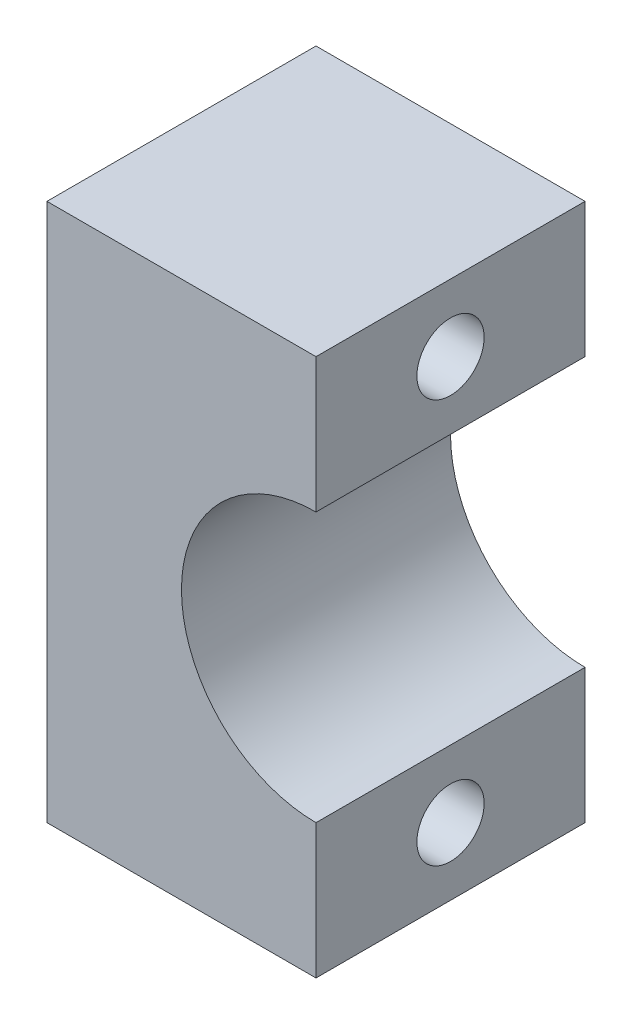
from build123d import *

# Parameters (mm, degrees)
EXTRUDE_1_DEPTH     = 20
SKETCH_3_R          = 2.5
CUT_EXTRUDE_1_DEPTH = 20
SKETCH_9_W          = 6.520982116
SKETCH_9_H          = 12.021095894
CUT_EXTRUDE_4_DEPTH = 5
SKETCH_10_R         = 1
CUT_EXTRUDE_6_DEPTH = 7


with BuildPart() as part:
    # 草图1 → 凸台-拉伸1 (new body)
    with BuildSketch(Plane.XY):
        with BuildLine():
            Line((0, 20), (0, 10))
            ThreePointArc((0, 10), (-10, 0), (0, -10))
            Line((0, -10), (0, -20))
            Line((0, -20), (-20, -20))
            Line((-20, -20), (-20, 20))
            Line((-20, 20), (0, 20))
        make_face()
    extrude(amount=EXTRUDE_1_DEPTH)

    # 草图3 → 切除-拉伸1 (cut)
    with BuildSketch(Plane(origin=(0, 0, 0), x_dir=(0, 0, -1), z_dir=(1, 0, 0))):
        with Locations((-10, 15)):
            Circle(SKETCH_3_R)
        with Locations((-10, -15)):
            Circle(SKETCH_3_R)
    extrude(amount=-CUT_EXTRUDE_1_DEPTH, mode=Mode.SUBTRACT)

    # 草图9 → 切除-拉伸4 (cut)
    with BuildSketch(Plane(origin=(-20, 0, 0), x_dir=(0, 0, -1), z_dir=(1, 0, 0))):
        with Locations((-10, 0)):
            Rectangle(SKETCH_9_W, SKETCH_9_H)
    extrude(amount=CUT_EXTRUDE_4_DEPTH, mode=Mode.SUBTRACT)

    # 草图10 → 切除-拉伸6 (cut)
    with BuildSketch(Plane.XY):
        with Locations((-16.577606786, 0)):
            Circle(SKETCH_10_R)
    extrude(amount=CUT_EXTRUDE_6_DEPTH, mode=Mode.SUBTRACT)


solid = part.part
